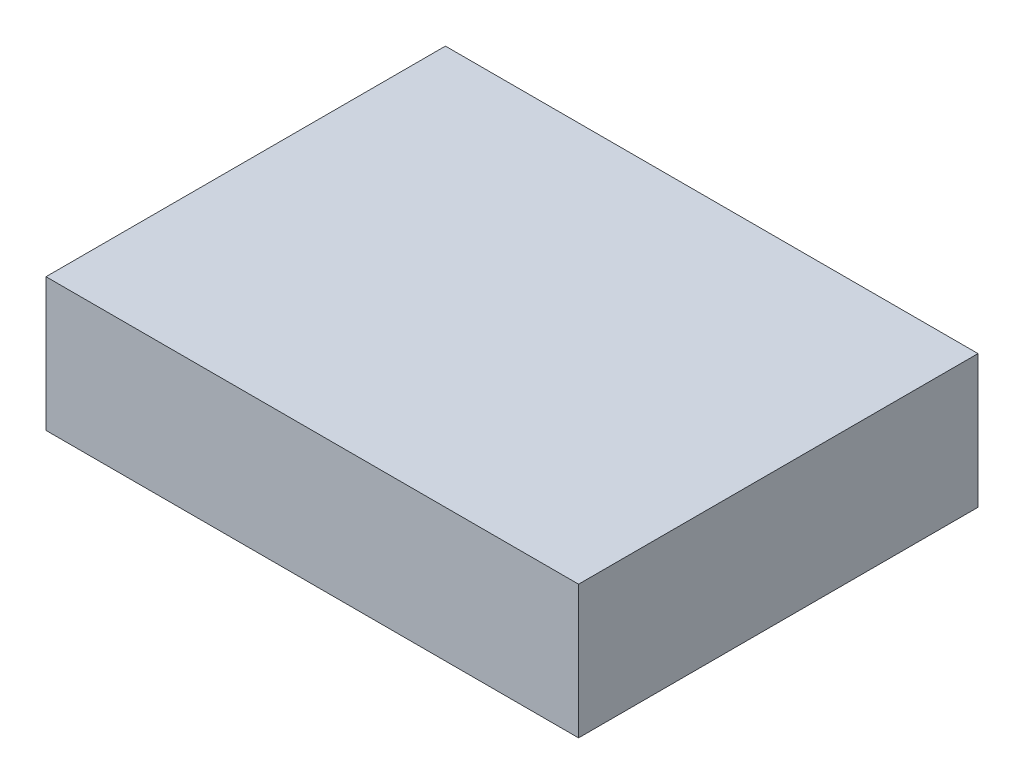
from build123d import *

# Parameters (mm, degrees)
SKETCH1_W      = 203.2
SKETCH1_H      = 50.8
EXTRUDE1_DEPTH = 152.4


with BuildPart() as part:
    # Sketch1 → Extrude1 (new body)
    with BuildSketch(Plane.XY):
        with Locations((76.2, -25.4)):
            Rectangle(SKETCH1_W, SKETCH1_H)
    extrude(amount=EXTRUDE1_DEPTH)


solid = part.part
